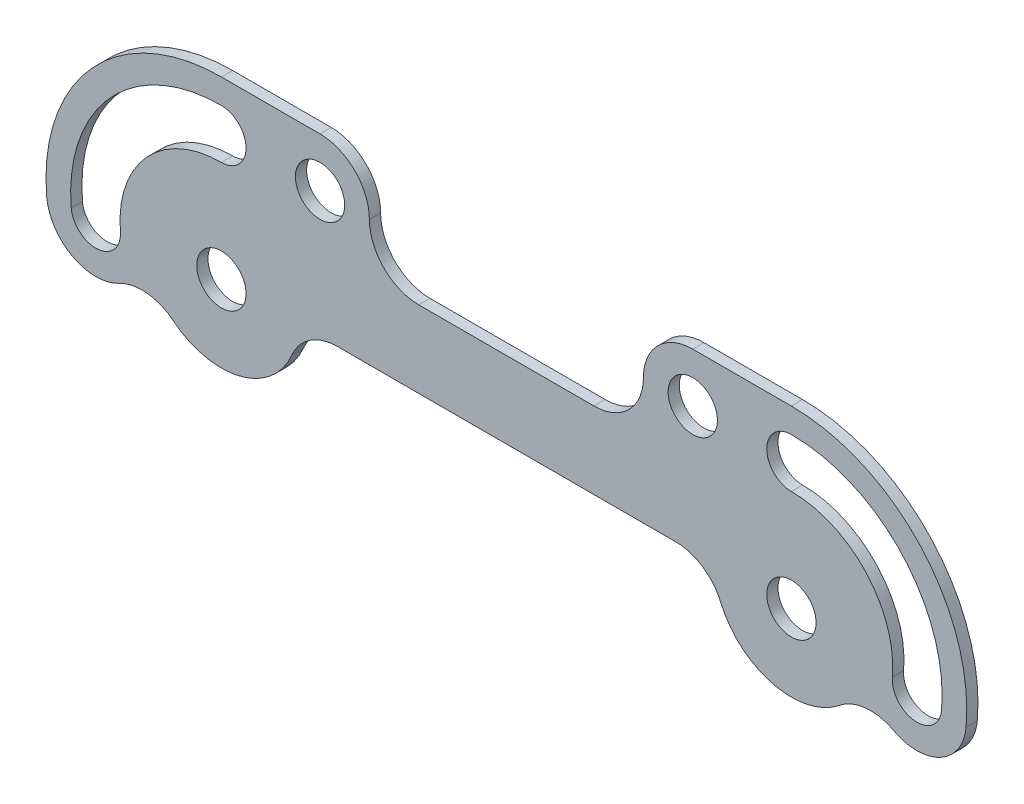
from build123d import *

# Parameters (mm, degrees)
SKETCH1_R           = 1.7859375
BOSS_EXTRUDE1_DEPTH = 0.8128


with BuildPart() as part:
    # Sketch1 → Boss-Extrude1 (new body)
    with BuildSketch(Plane.XY):
        with BuildLine():
            ThreePointArc((5.113201945, -2.174184888), (6.429738065, -0.592725341), (8.400260413, 0))
            Line((8.400260413, 0), (32.874739587, 0))
            ThreePointArc((32.874739587, 0), (34.845261898, -0.592725316), (36.161798019, -2.174184805))
            ThreePointArc((36.161798019, -2.174184805), (39.929142732, -5.390786796), (44.766280182, -4.322369345))
            ThreePointArc((44.766280182, -4.322369345), (46.671647173, -3.545286328), (48.689532151, -3.948301971))
            ThreePointArc((48.689532151, -3.948301971), (52.071763604, -3.935123969), (53.926672666, -1.106877933))
            ThreePointArc((53.926672666, -1.106877933), (50.638422177, 8.579995637), (41.275, 12.7))
            Line((41.275, 12.7), (34.13125, 12.7))
            ThreePointArc((34.13125, 12.7), (31.605552966, 11.653822034), (30.559375, 9.128125))
            ThreePointArc((30.559375, 9.128125), (29.513197034, 6.602427966), (26.9875, 5.55625))
            Line((26.9875, 5.55625), (14.2875, 5.55625))
            ThreePointArc((14.2875, 5.55625), (11.761802966, 6.602427966), (10.715625, 9.128125))
            ThreePointArc((10.715625, 9.128125), (9.669447034, 11.653822034), (7.14375, 12.7))
            Line((7.14375, 12.7), (0, 12.7))
            ThreePointArc((0, 12.7), (-9.363422177, 8.579995637), (-12.651672666, -1.106877933))
            ThreePointArc((-12.651672666, -1.106877933), (-10.796763578, -3.935123983), (-7.414532098, -3.948301943))
            ThreePointArc((-7.414532098, -3.948301943), (-5.396647132, -3.545286332), (-3.491280162, -4.322369361))
            ThreePointArc((-3.491280162, -4.322369361), (1.345857236, -5.390786804), (5.113201945, -2.174184888))
        make_face()
        with BuildLine():
            ThreePointArc((52.147531197, -0.951223224), (50.212735019, -2.574709983), (48.58924826, -0.639913805))
            ThreePointArc((48.58924826, -0.639913805), (46.688228446, 4.960309977), (41.275, 7.3421875))
            ThreePointArc((41.275, 7.3421875), (39.4890625, 9.128125), (41.275, 10.9140625))
            ThreePointArc((41.275, 10.9140625), (49.321690934, 7.37343375), (52.147531197, -0.951223224))
        make_face(mode=Mode.SUBTRACT)
        with BuildLine():
            ThreePointArc((0, 10.9140625), (1.7859375, 9.128125), (0, 7.3421875))
            ThreePointArc((0, 7.3421875), (-5.413228446, 4.960309977), (-7.31424826, -0.639913805))
            ThreePointArc((-7.31424826, -0.639913805), (-8.937735019, -2.574709983), (-10.872531197, -0.951223224))
            ThreePointArc((-10.872531197, -0.951223224), (-8.046690934, 7.37343375), (0, 10.9140625))
        make_face(mode=Mode.SUBTRACT)
        Circle(SKETCH1_R, mode=Mode.SUBTRACT)
        with Locations((41.275, 0)):
            Circle(SKETCH1_R, mode=Mode.SUBTRACT)
        with Locations((7.14375, 9.128125)):
            Circle(SKETCH1_R, mode=Mode.SUBTRACT)
        with Locations((34.13125, 9.128125)):
            Circle(SKETCH1_R, mode=Mode.SUBTRACT)
    extrude(amount=BOSS_EXTRUDE1_DEPTH)


solid = part.part
